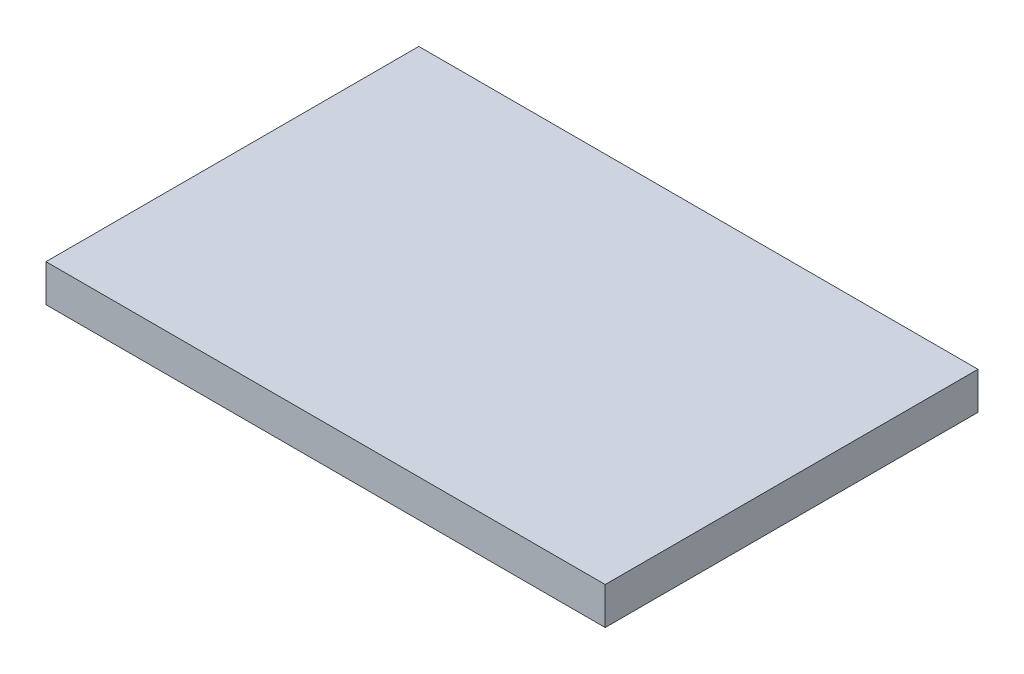
from build123d import *

# Parameters (mm, degrees)
ESBO_O1_W                = 450
ESBO_O1_H                = 300
RESSALTO_EXTRUS_O1_DEPTH = 30


with BuildPart() as part:
    # Esboço1 → Ressalto-extrusão1 (new body)
    with BuildSketch(Plane(origin=(0, 0, 0), x_dir=(1, 0, 0), z_dir=(0, 1, 0))):
        Rectangle(ESBO_O1_W, ESBO_O1_H)
    extrude(amount=RESSALTO_EXTRUS_O1_DEPTH)


solid = part.part
